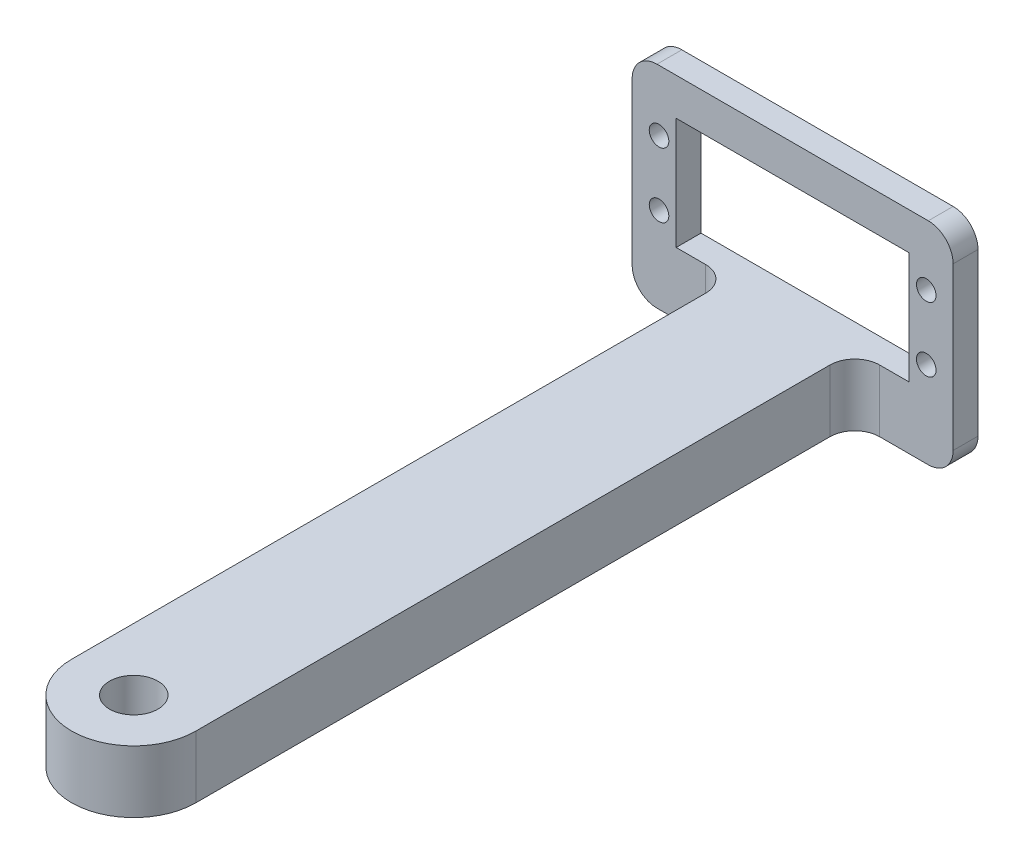
from build123d import *

# Parameters (mm, degrees)
SKETCH1_W           = 12.7
SKETCH1_H           = 6.35
BOSS_EXTRUDE1_DEPTH = 38.1
CUT_EXTRUDE1_REACH  = 41.144
SKETCH2_R           = 2.4765
FILLET1_RADIUS      = 6.35
FILLET1_LENGTH      = 6.35
SKETCH3_W           = 32.7914
SKETCH3_H           = 21.59
SKETCH3_R           = 0.999998
SKETCH3_W_2         = 23.7998
SKETCH3_H_2         = 11.43
BOSS_EXTRUDE2_DEPTH = 2.54
FILLET3_R           = 2.54


with BuildPart() as part:
    # Sketch1 → Boss-Extrude1 (new, symmetric)
    with BuildSketch(Plane.XY):
        Rectangle(SKETCH1_W, SKETCH1_H)
    extrude(amount=BOSS_EXTRUDE1_DEPTH, both=True)

    # Sketch2 → Cut-Extrude1 (cut, up to next)
    with BuildSketch(Plane(origin=(0, 3.175, 0), x_dir=(1, 0, 0), z_dir=(0, 1, 0)), mode=Mode.PRIVATE) as cut_extrude1_sk1:
        with Locations(Location((0, -31.75, 0), (0, 0, 270))):
            Circle(SKETCH2_R)
    cut_extrude1_tool1 = extrude(cut_extrude1_sk1.sketch, amount=-CUT_EXTRUDE1_REACH, mode=Mode.PRIVATE) & part.part
    add(cut_extrude1_tool1.solids().sort_by_distance((0, 3.175, 31.75))[0], mode=Mode.SUBTRACT)

    # Fillet1: full round fillet: the end face becomes a half cylinder, R = half its width
    fillet1_face = Plane((0, 0, 38.1), x_dir=(0, 1, 0), z_dir=(0, 0, 1))  # on the end face: x along it, z out of the body
    fillet1_slab = fillet1_face.offset(-FILLET1_RADIUS / 2) * Box(FILLET1_LENGTH, 2 * FILLET1_RADIUS, FILLET1_RADIUS, mode=Mode.PRIVATE)  # the body's end, R deep
    fillet1_round = Plane((0, 0, 31.75), x_dir=(0, 0, 1), z_dir=(0, 1, 0)) * Cylinder(FILLET1_RADIUS, FILLET1_LENGTH, mode=Mode.PRIVATE)  # its axis R under the face
    add(fillet1_slab - fillet1_round, mode=Mode.SUBTRACT)

    # Sketch3 → Boss-Extrude2 (add)
    with BuildSketch(Plane(origin=(0, 0, -38.1), x_dir=(-1, 0, 0), z_dir=(0, 0, -1))):
        with Locations((0, 7.62)):
            Rectangle(SKETCH3_W, SKETCH3_H)
        with Locations((13.65, 5.588)):
            Circle(SKETCH3_R, mode=Mode.SUBTRACT)
        with Locations((13.65, 12.192)):
            Circle(SKETCH3_R, mode=Mode.SUBTRACT)
        with Locations((-13.65, 5.588)):
            Circle(SKETCH3_R, mode=Mode.SUBTRACT)
        with Locations((-13.65, 12.192)):
            Circle(SKETCH3_R, mode=Mode.SUBTRACT)
        with Locations((0, 8.89)):
            Rectangle(SKETCH3_W_2, SKETCH3_H_2, mode=Mode.SUBTRACT)
    extrude(amount=-BOSS_EXTRUDE2_DEPTH)

    # Fillet3
    fillet3_edges = [part.edges().sort_by_distance(p)[0] for p in [
        (-6.35, 0, -35.56),
        (6.35, 0, -35.56),
        (-16.3957, -3.175, -36.83),
        (16.3957, -3.175, -36.83),
        (16.3957, 18.415, -36.83),
        (-16.3957, 18.415, -36.83),
    ]]
    fillet(fillet3_edges, radius=FILLET3_R)


solid = part.part
